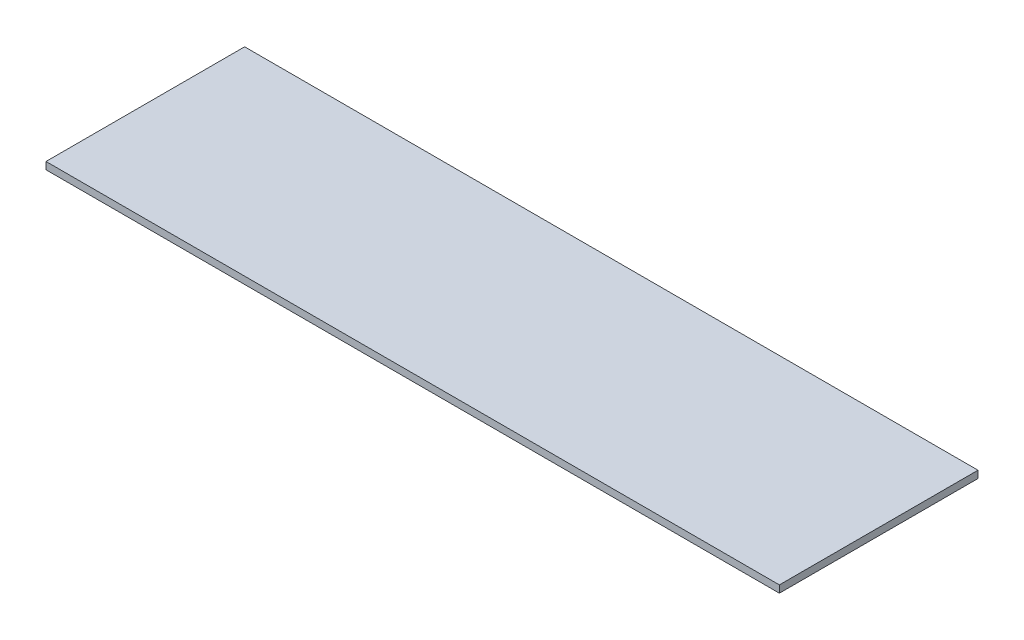
from build123d import *

# Parameters (mm, degrees)
SKETCH1_W           = 609.6
SKETCH1_H           = 165.1
BOSS_EXTRUDE1_DEPTH = 6


with BuildPart() as part:
    # Sketch1 → Boss-Extrude1 (new body)
    with BuildSketch(Plane(origin=(0, 0, 0), x_dir=(1, 0, 0), z_dir=(0, 1, 0))):
        Rectangle(SKETCH1_W, SKETCH1_H)
    extrude(amount=BOSS_EXTRUDE1_DEPTH)


solid = part.part
